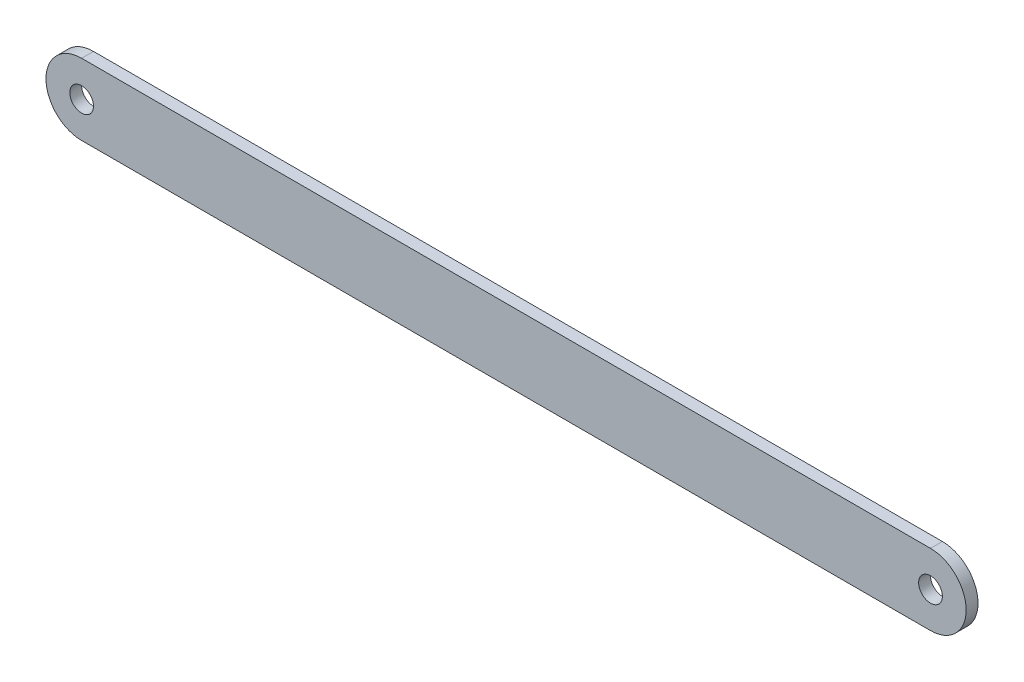
from build123d import *

# Parameters (mm, degrees)
ESQUISSE1_R        = 2
BOSS_EXTRU_1_DEPTH = 2


with BuildPart() as part:
    # Esquisse1 → Boss.-Extru.1 (new body)
    with BuildSketch(Plane.XY):
        with BuildLine():
            Line((-71.5, 6), (71.5, 6))
            ThreePointArc((71.5, 6), (77.5, 0), (71.5, -6))
            Line((71.5, -6), (-71.5, -6))
            ThreePointArc((-71.5, -6), (-77.5, 0), (-71.5, 6))
        make_face()
        with Locations((-71.5, 0)):
            Circle(ESQUISSE1_R, mode=Mode.SUBTRACT)
        with Locations((71.5, 0)):
            Circle(ESQUISSE1_R, mode=Mode.SUBTRACT)
    extrude(amount=BOSS_EXTRU_1_DEPTH)


solid = part.part
